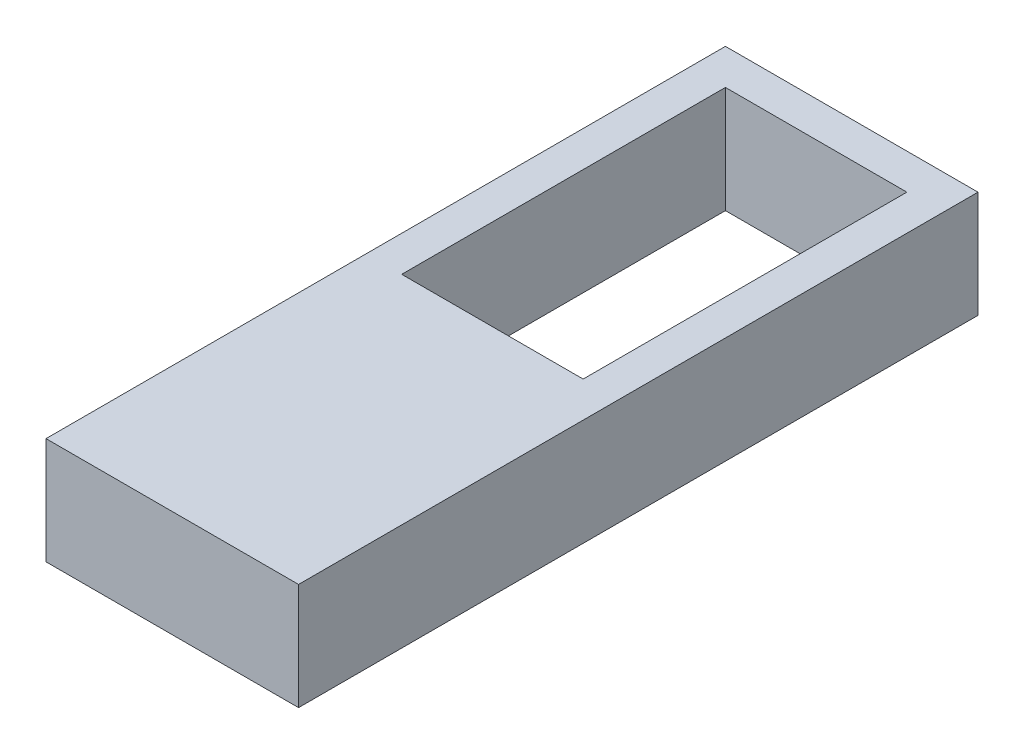
from build123d import *

# Parameters (mm, degrees)
SKETCH1_W           = 7.1
SKETCH1_H           = 11.1
SKETCH1_W_2         = 5.1
SKETCH1_H_2         = 9.1
SKETCH1_H_3         = 8
BOSS_EXTRUDE1_DEPTH = 3


with BuildPart() as part:
    # Sketch1 → Boss-Extrude1 (new body)
    # profile 1 of 2: a face of its own
    with BuildSketch(Plane(origin=(0, 0, 0), x_dir=(1, 0, 0), z_dir=(0, 1, 0))):
        with Locations((2.55, -4.55)):
            Rectangle(SKETCH1_W, SKETCH1_H)
        with Locations((2.55, -4.55)):
            Rectangle(SKETCH1_W_2, SKETCH1_H_2, mode=Mode.SUBTRACT)
    # profile 2 of 2: a face of its own
    with BuildSketch(Plane(origin=(0, 0, 0), x_dir=(1, 0, 0), z_dir=(0, 1, 0))):
        with Locations((2.55, -14.1)):
            Rectangle(SKETCH1_W, SKETCH1_H_3)
    extrude(amount=BOSS_EXTRUDE1_DEPTH)


solid = part.part
